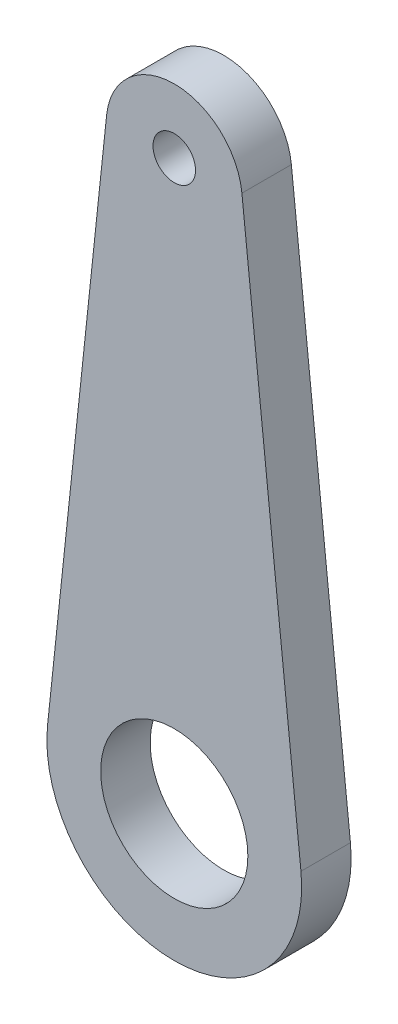
from build123d import *

# Parameters (mm, degrees)
SKETCH1_R           = 3.77825
SKETCH1_R_2         = 1.0922
BOSS_EXTRUDE1_DEPTH = 2.54


with BuildPart() as part:
    # Sketch1 → Boss-Extrude1 (new body)
    with BuildSketch(Plane.XY):
        with BuildLine():
            Line((-6.504163608, 0.688473684), (-3.473097072, 29.323631579))
            ThreePointArc((-3.473097072, 29.323631579), (0, 32.4485), (3.473097072, 29.323631579))
            Line((3.473097072, 29.323631579), (6.504163608, 0.688473684))
            ThreePointArc((6.504163608, 0.688473684), (0, -6.5405), (-6.504163608, 0.688473684))
        make_face()
        Circle(SKETCH1_R, mode=Mode.SUBTRACT)
        with Locations((0, 29.1465)):
            Circle(SKETCH1_R_2, mode=Mode.SUBTRACT)
    extrude(amount=BOSS_EXTRUDE1_DEPTH)


solid = part.part
